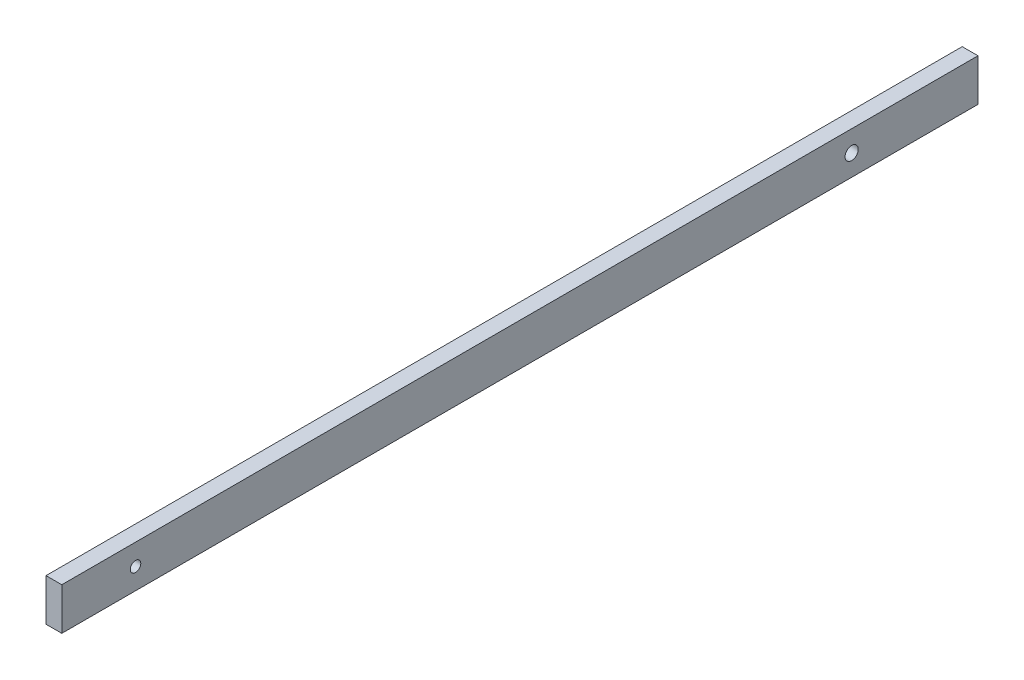
from build123d import *

# Parameters (mm, degrees)
SKETCH1_W           = 19.05
SKETCH1_H           = 1104.9
BOSS_EXTRUDE1_DEPTH = 50.8
SKETCH2_R           = 7.9375
SKETCH2_R_2         = 6.35
CUT_EXTRUDE1_DEPTH  = 556.107687751


with BuildPart() as part:
    # Sketch1 → Boss-Extrude1 (new body)
    with BuildSketch(Plane(origin=(0, 0, 0), x_dir=(1, 0, 0), z_dir=(0, 1, 0))):
        Rectangle(SKETCH1_W, SKETCH1_H)
    extrude(amount=-BOSS_EXTRUDE1_DEPTH)

    # Sketch2 → Cut-Extrude1 (cut, through all)
    with BuildSketch(Plane(origin=(9.525, 0, 0), x_dir=(0, 0, -1), z_dir=(1, 0, 0))):
        with Locations((400.05, -25.4)):
            Circle(SKETCH2_R)
        with Locations((-463.55, -25.4)):
            Circle(SKETCH2_R_2)
    extrude(amount=-CUT_EXTRUDE1_DEPTH, mode=Mode.SUBTRACT)


solid = part.part
